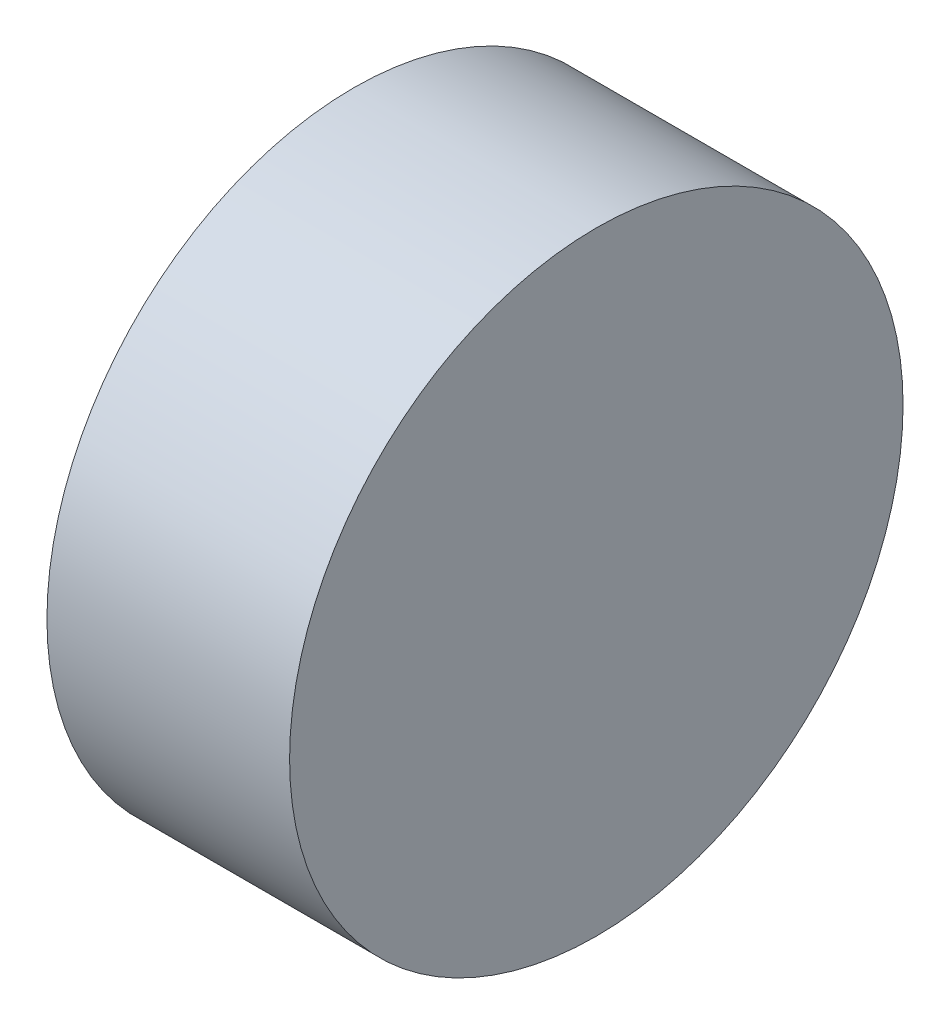
from build123d import *

# Parameters (mm, degrees)
SKETCH_4_R          = 33.5
EXTRUDE_1_DEPTH     = 26.5
SKETCH_5_R          = 3
CUT_EXTRUDE_1_DEPTH = 9
EXTRUDE_START       = 2.5
SKETCH_6_R          = 5.75
SKETCH_6_R_2        = 3
EXTRUDE_3_DEPTH     = 2.5


with BuildPart() as part:
    # 草图4 → 凸台-拉伸1 (new body)
    with BuildSketch(Plane(origin=(0, 0, 0), x_dir=(0, 0, -1), z_dir=(1, 0, 0))):
        Circle(SKETCH_4_R)
    extrude(amount=EXTRUDE_1_DEPTH)

    # 草图5 → 切除-拉伸1 (cut)
    with BuildSketch(Plane.ZY):
        Circle(SKETCH_5_R)
    extrude(amount=-CUT_EXTRUDE_1_DEPTH, mode=Mode.SUBTRACT)

    # 草图6 → 凸台-拉伸3 (add)
    with BuildSketch(Plane.ZY.offset(EXTRUDE_START)):
        with Locations(Location((0, 0, 0), (0, 0, 180))):
            Circle(SKETCH_6_R)
        Circle(SKETCH_6_R_2, mode=Mode.SUBTRACT)
    extrude(amount=-EXTRUDE_3_DEPTH)


solid = part.part
